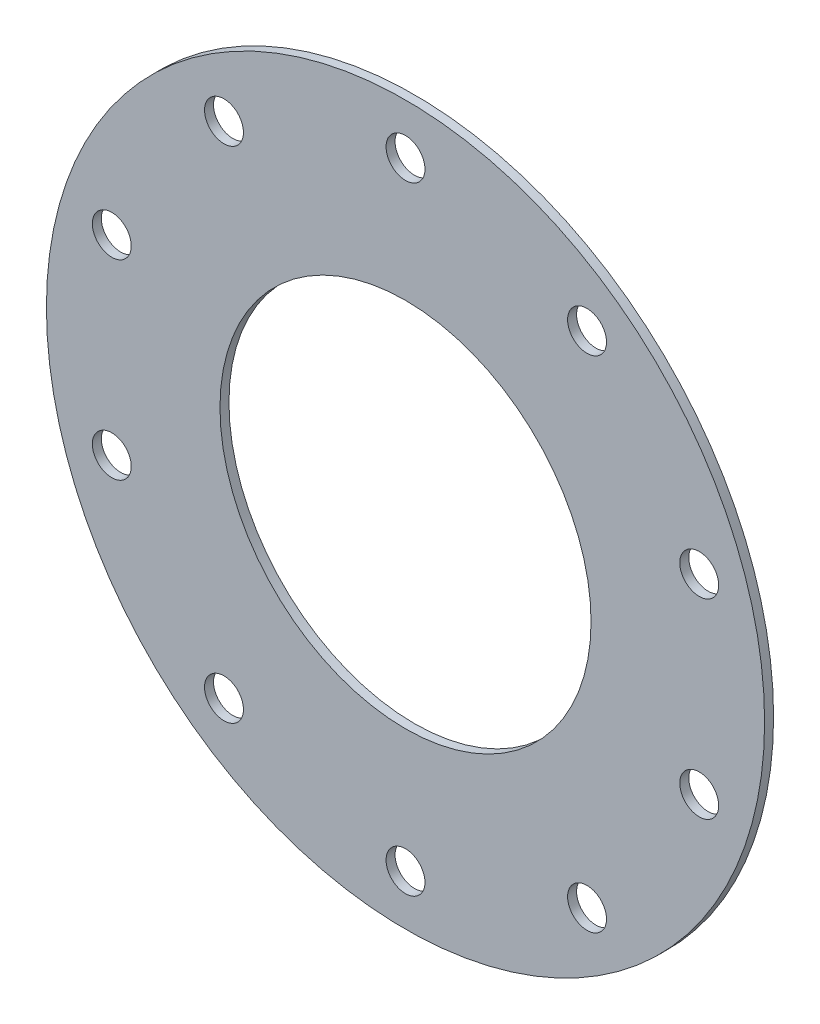
from build123d import *

# Parameters (mm, degrees)
SKETCH1_R           = 60
SKETCH1_R_2         = 31
SKETCH1_R_3         = 3.25
BOSS_EXTRUDE1_DEPTH = 1.5


with BuildPart() as part:
    # Sketch1 → Boss-Extrude1 (new body)
    with BuildSketch(Plane.XY):
        Circle(SKETCH1_R)
        Circle(SKETCH1_R_2, mode=Mode.SUBTRACT)
        with Locations((0, 51.6)):
            Circle(SKETCH1_R_3, mode=Mode.SUBTRACT)
        with Locations((30.329719018, 41.74527691)):
            Circle(SKETCH1_R_3, mode=Mode.SUBTRACT)
        with Locations((49.074516241, 15.94527691)):
            Circle(SKETCH1_R_3, mode=Mode.SUBTRACT)
        with Locations((49.074516241, -15.94527691)):
            Circle(SKETCH1_R_3, mode=Mode.SUBTRACT)
        with Locations((30.329719018, -41.74527691)):
            Circle(SKETCH1_R_3, mode=Mode.SUBTRACT)
        with Locations((0, -51.6)):
            Circle(SKETCH1_R_3, mode=Mode.SUBTRACT)
        with Locations((-30.329719018, -41.74527691)):
            Circle(SKETCH1_R_3, mode=Mode.SUBTRACT)
        with Locations((-49.074516241, -15.94527691)):
            Circle(SKETCH1_R_3, mode=Mode.SUBTRACT)
        with Locations((-49.074516241, 15.94527691)):
            Circle(SKETCH1_R_3, mode=Mode.SUBTRACT)
        with Locations((-30.329719018, 41.74527691)):
            Circle(SKETCH1_R_3, mode=Mode.SUBTRACT)
    extrude(amount=BOSS_EXTRUDE1_DEPTH)


solid = part.part
